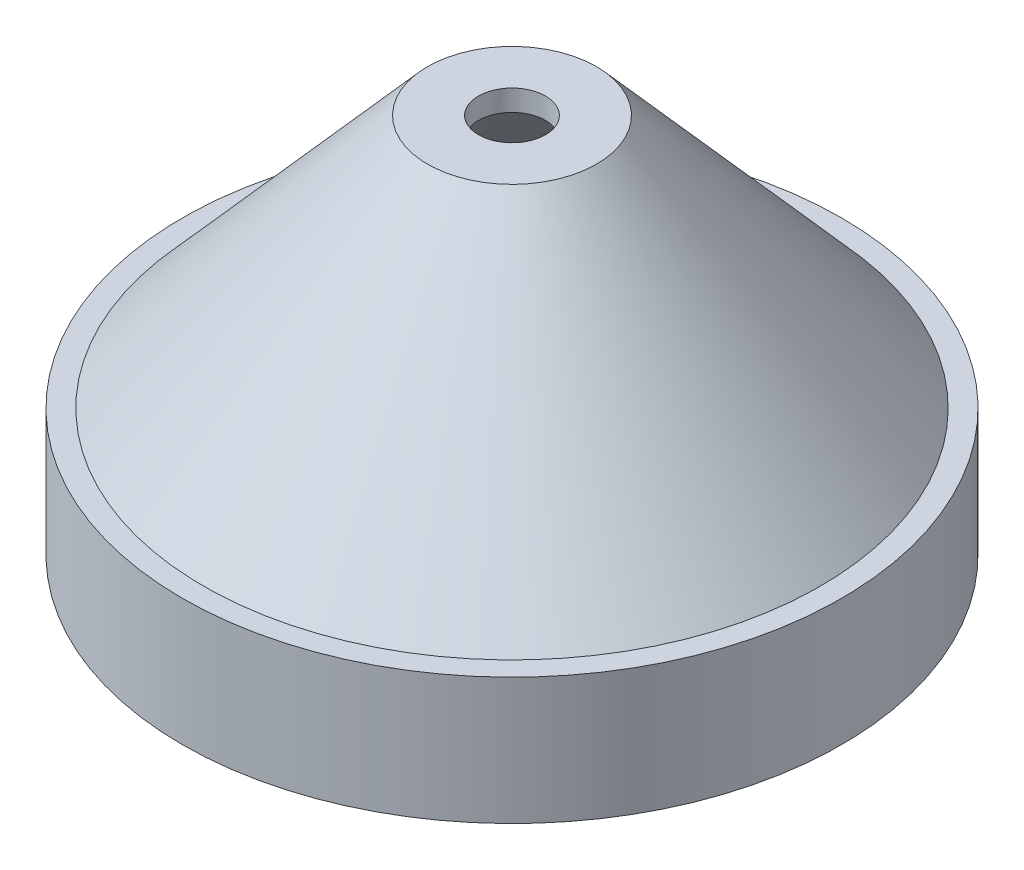
from build123d import *

# Parameters (mm, degrees)
SKETCH1_R                   = 49.53
BOSS_EXTRUDE1_DEPTH         = 76.2
SHELL1_T                    = -3.175
F_3_8_CLEARANCE_HOLE1_D     = 10.0838
F_3_8_CLEARANCE_HOLE1_DEPTH = 25.4
F_3_8_CLEARANCE_HOLE1_TIP   = 3.029479155


with BuildPart() as part:
    # Sketch1 → Boss-Extrude1 (new body)
    with BuildSketch(Plane(origin=(0, 0, 0), x_dir=(1, 0, 0), z_dir=(0, 1, 0))):
        with Locations(Location((0, 0, 0), (0, 0, 90))):
            Circle(SKETCH1_R)
    extrude(amount=BOSS_EXTRUDE1_DEPTH)

    # Sketch8 → Cut-Revolve1 (revolve, cut)
    with BuildSketch(Plane.XY, mode=Mode.PRIVATE) as cut_revolve1_sk:
        Polygon((49.53, 19.05), (46.355, 19.05), (12.7, 57.15), (0, 57.15), (0, 76.2), (49.53, 76.2), align=None)
    revolve(cut_revolve1_sk.sketch.rotate(Axis((0, 76.2, 0), (0, -1, 0)), 270), axis=Axis((0, 76.2, 0), (0, -1, 0)), mode=Mode.SUBTRACT)

    # Shell1
    shell1_openings = [part.faces().sort_by_distance(p)[0] for p in [
        (0, 0, 0),
    ]]
    offset(amount=SHELL1_T, openings=shell1_openings, kind=Kind.INTERSECTION)

    # 3/8 Clearance Hole1
    with Locations(Plane(origin=(0, 57.15, 0), x_dir=(1, 0, 0), z_dir=(0, 1, 0))):
        with Locations((0, 0)):
            Hole(F_3_8_CLEARANCE_HOLE1_D / 2, depth=F_3_8_CLEARANCE_HOLE1_DEPTH)
            with Locations((0, 0, -(F_3_8_CLEARANCE_HOLE1_DEPTH + F_3_8_CLEARANCE_HOLE1_TIP / 2))):  # 118° drill point
                Cone(0, F_3_8_CLEARANCE_HOLE1_D / 2, F_3_8_CLEARANCE_HOLE1_TIP, mode=Mode.SUBTRACT)


solid = part.part
